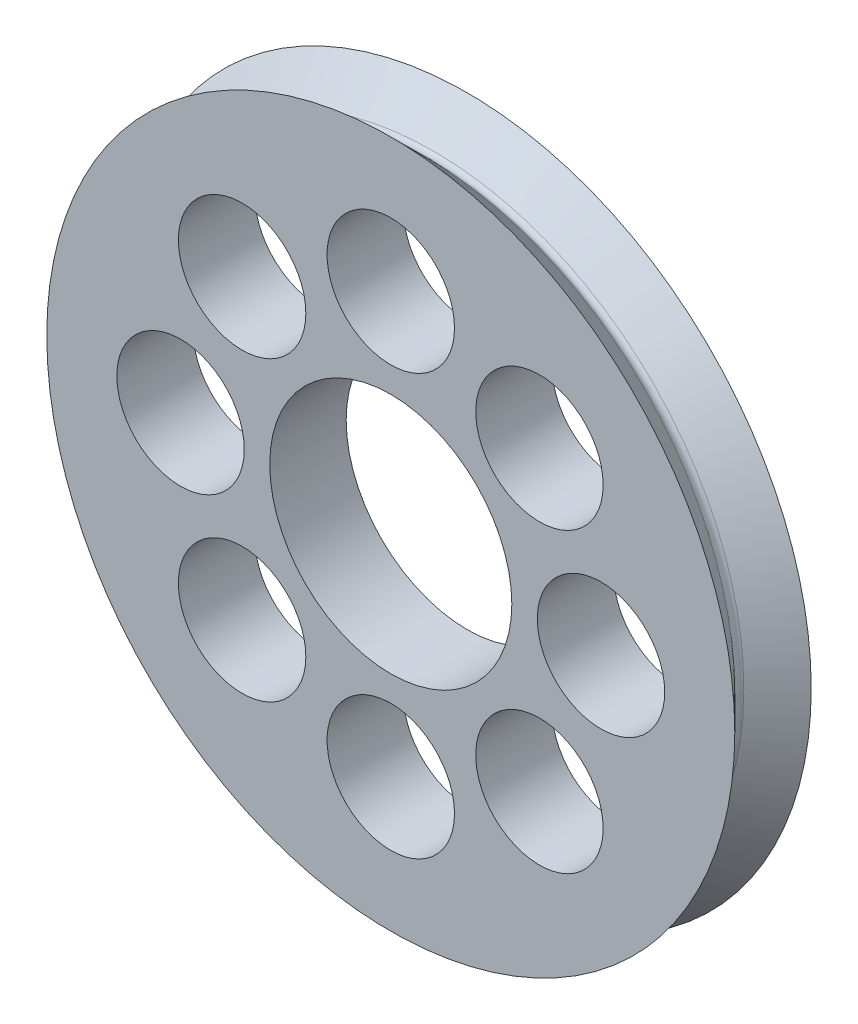
from build123d import *

# Parameters (mm, degrees)
SKETCH_6_R          = 5
CUT_EXTRUDE_2_DEPTH = 10


with BuildPart() as part:
    # 草图2 → 旋转1 (revolve)
    with BuildSketch(Plane(origin=(0, 0, 0), x_dir=(1, 0, 0), z_dir=(0, 1, 0))):
        with BuildLine():
            Line((9.5, 3), (9.5, -3))
            Line((9.5, -3), (27, -3))
            Line((27, -3), (24.353553391, -0.353553391))
            ThreePointArc((24.353553391, -0.353553391), (24.207106781, 0), (24.353553391, 0.353553391))
            Line((24.353553391, 0.353553391), (27, 3))
            Line((27, 3), (9.5, 3))
        make_face()
    revolve(axis=Axis((0, 0, 0), (0, 0, -1)))

    # 草图6 → 切除-拉伸2 (cut)
    with BuildSketch(Plane.XY.offset(3)):
        with Locations((16.5, 0)):
            Circle(SKETCH_6_R)
        with Locations((11.66726189, -11.66726189)):
            Circle(SKETCH_6_R)
        with Locations((0, -16.5)):
            Circle(SKETCH_6_R)
        with Locations((-11.66726189, -11.66726189)):
            Circle(SKETCH_6_R)
        with Locations((-16.5, 0)):
            Circle(SKETCH_6_R)
        with Locations((-11.66726189, 11.66726189)):
            Circle(SKETCH_6_R)
        with Locations((0, 16.5)):
            Circle(SKETCH_6_R)
        with Locations((11.66726189, 11.66726189)):
            Circle(SKETCH_6_R)
    extrude(amount=-CUT_EXTRUDE_2_DEPTH, mode=Mode.SUBTRACT)


solid = part.part
